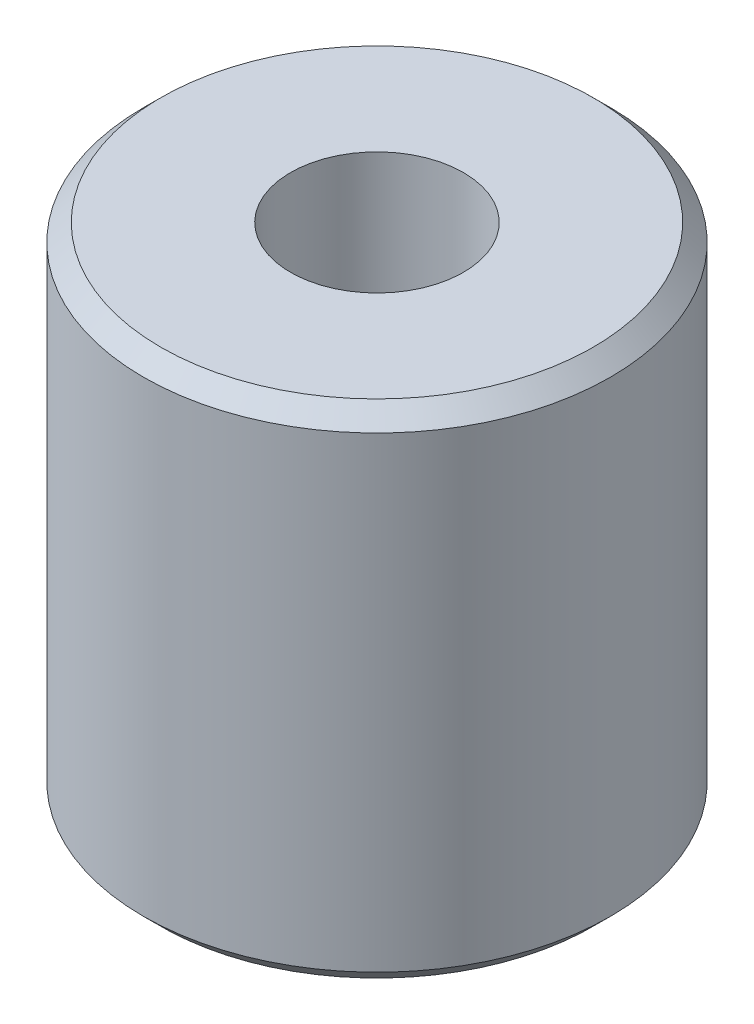
from build123d import *

# Parameters (mm, degrees)
ESQUISSE1_W             = 13.5
ESQUISSE1_H             = 29
ESQUISSE2_R             = 11.5
ENL_V_MAT_EXTRU_1_DEPTH = 4
CHANFREIN1_SIZE         = 1
ESQUISSE4_R             = 8
ENL_V_MAT_EXTRU_2_DEPTH = 10
ESQUISSE5_R             = 5
ENL_V_MAT_EXTRU_3_DEPTH = 25.279621196
ENL_V_MAT_EXTRU_4_REACH = 43.033
ESQUISSE6_R             = 3


with BuildPart() as part:
    # Esquisse1 → Base-Révolution (revolve)
    with BuildSketch(Plane.XY, mode=Mode.PRIVATE) as base_r_volution_sk:
        with Locations((6.75, 14.5)):
            Rectangle(ESQUISSE1_W, ESQUISSE1_H)
    revolve(base_r_volution_sk.sketch.rotate(Axis((0, 0, 0), (0, 1, 0)), 90), axis=Axis((0, 0, 0), (0, 1, 0)))

    # Esquisse2 → Enlèv. mat.-Extru.1 (cut)
    with BuildSketch(Plane.XZ):
        with Locations(Location((0, 0, 0), (0, 0, 270))):
            Circle(ESQUISSE2_R)
    extrude(amount=-ENL_V_MAT_EXTRU_1_DEPTH, mode=Mode.SUBTRACT)

    # Chanfrein1
    chanfrein1_edges = [part.edges().sort_by_distance(p)[0] for p in [
        (0, 0, 13.5),
        (0, 29, 13.5),
    ]]
    chamfer(chanfrein1_edges, length=CHANFREIN1_SIZE)

    # Esquisse3 → Enlèvement de matière-Révolution1 (revolve, cut)
    with BuildSketch(Plane(origin=(0, 0, 0), x_dir=(1, 0, 0), z_dir=(0, 1, 0))):
        Polygon((0, 12.2), (16.5, 12.2), (21.5, 17.2), (0, 17.2), align=None)
    revolve(axis=Axis((0, 0, 0), (0, 0, -1)), mode=Mode.SUBTRACT)

    # Esquisse4 → Enlèv. mat.-Extru.2 (cut)
    with BuildSketch(Plane.XZ.offset(-4)):
        with Locations(Location((0, 0, 0), (0, 0, 270))):
            Circle(ESQUISSE4_R)
    extrude(amount=-ENL_V_MAT_EXTRU_2_DEPTH, mode=Mode.SUBTRACT)

    # Esquisse5 → Enlèv. mat.-Extru.3 (cut, through all)
    with BuildSketch(Plane.XZ.offset(-14)):
        with Locations(Location((0, 0, 0), (0, 0, 270))):
            Circle(ESQUISSE5_R)
    extrude(amount=-ENL_V_MAT_EXTRU_3_DEPTH, mode=Mode.SUBTRACT)

    # Esquisse6 → Enlèv. mat.-Extru.4 (cut, up to next)
    with BuildSketch(Plane(origin=(0, 0, -12.2), x_dir=(-1, 0, 0), z_dir=(0, 0, -1)), mode=Mode.PRIVATE) as enl_v_mat_extru_4_sk1:
        with Locations((0, 8)):
            Circle(ESQUISSE6_R)
    enl_v_mat_extru_4_tool1 = extrude(enl_v_mat_extru_4_sk1.sketch, amount=-ENL_V_MAT_EXTRU_4_REACH, mode=Mode.PRIVATE) & part.part
    add(enl_v_mat_extru_4_tool1.solids().sort_by_distance((0, 8, -12.2))[0], mode=Mode.SUBTRACT)


solid = part.part
